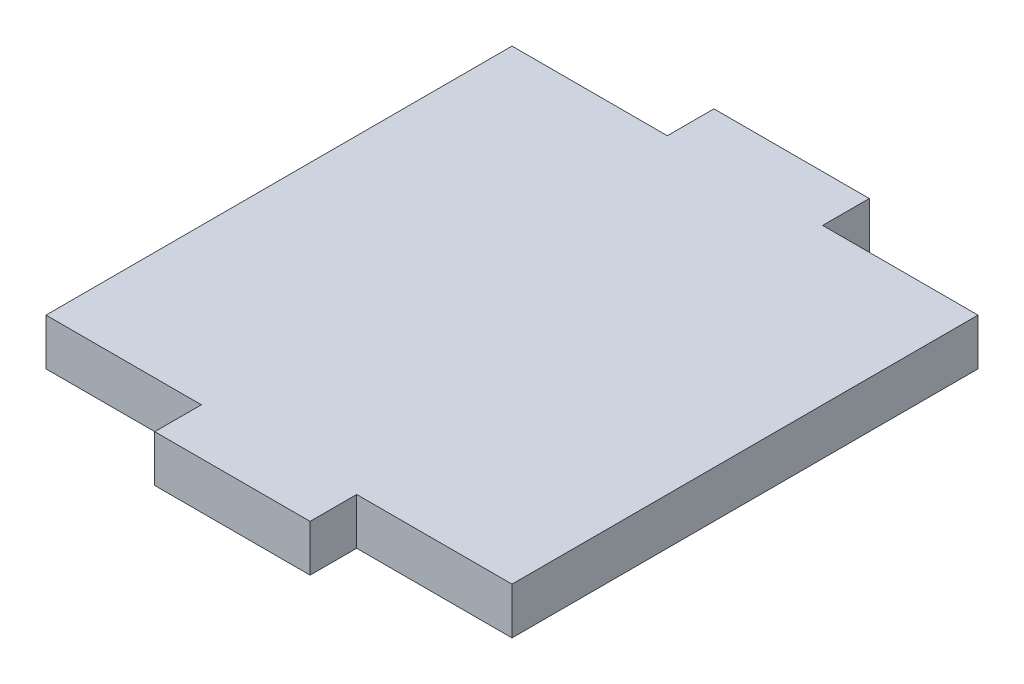
from build123d import *

# Parameters (mm, degrees)
BOSS_EXTRUDE1_DEPTH = 3


with BuildPart() as part:
    # Sketch1 → Boss-Extrude1 (new body)
    with BuildSketch(Plane(origin=(0, 0, 0), x_dir=(1, 0, 0), z_dir=(0, 1, 0))):
        Polygon((-15, -15), (-5, -15), (-5, -18), (5, -18), (5, -15), (15, -15), (15, 15), (5, 15), (5, 18), (-5, 18), (-5, 15), (-15, 15), align=None)
    extrude(amount=BOSS_EXTRUDE1_DEPTH)


solid = part.part
